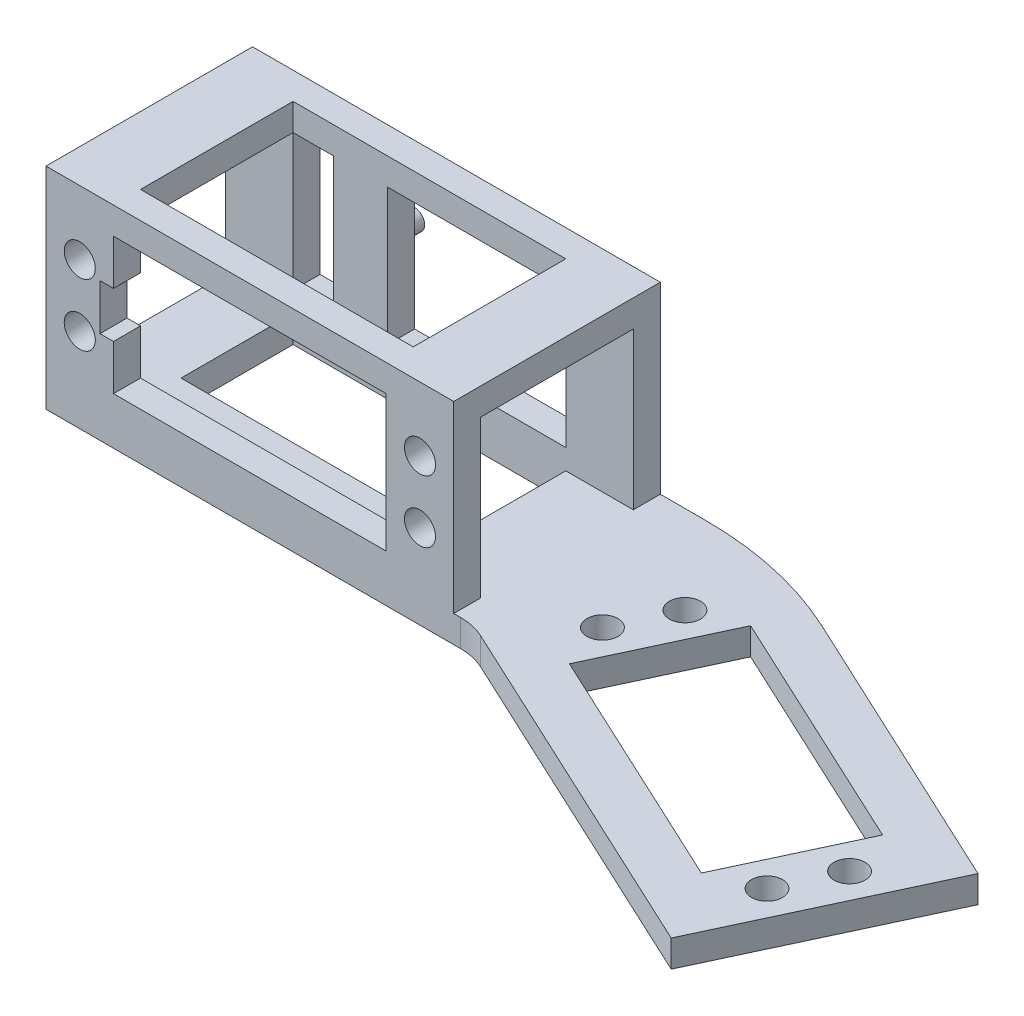
from build123d import *

# Parameters (mm, degrees)
SZKIC1_W                    = 60.4
SZKIC1_H                    = 34.2
DODANIE_WYCI_GNI_CIE1_DEPTH = 4
SZKIC2_R                    = 2.3
DODANIE_WYCI_GNI_CIE2_DEPTH = 4
SZKIC8_W                    = 60.4
SZKIC8_H                    = 32.2
SZKIC8_R                    = 2.3
SZKIC8_W_2                  = 40.4
SZKIC8_H_2                  = 20.2
DODANIE_WYCI_GNI_CIE3_DEPTH = 4
SZKIC10_R                   = 1.5
DODANIE_WYCI_GNI_CIE4_DEPTH = 4
DODANIE_WYCI_GNI_CIE5_START = -2
SZKIC11_W                   = 10
SZKIC11_H                   = 30.6
DODANIE_WYCI_GNI_CIE5_DEPTH = 5
WYTNIJ_WYCI_GNI_CIE1_DEPTH  = 3
SZKIC13_W                   = 6
SZKIC13_H                   = 20.2
SZKIC13_W_2                 = 26.4
WYTNIJ_WYCI_GNI_CIE2_DEPTH  = 4
WYTNIJ_WYCI_GNI_CIE3_REACH  = 189.798
SZKIC14_W                   = 2
SZKIC14_H                   = 6.8


with BuildPart() as part:
    # Szkic1 → Dodanie-wyciągnięcie1 (new body)
    with BuildSketch(Plane.XY):
        with Locations((20.2, 10.1)):
            Rectangle(SZKIC1_W, SZKIC1_H)
    extrude(amount=DODANIE_WYCI_GNI_CIE1_DEPTH)

    # Szkic2 → Dodanie-wyciągnięcie2 (add)
    with BuildSketch(Plane.XZ.offset(7)):
        with BuildLine():
            Line((-10, 4), (-10, 0))
            Line((-10, 0), (-16.721262857, 0))
            ThreePointArc((-16.721262857, 0), (-28.023032854, 1.237745118), (-38.789008699, 4.89230147))
            Line((-38.789008699, 4.89230147), (-82.189786852, 25.130416692))
            Line((-82.189786852, 25.130416692), (-67.736242301, 56.126143009))
            Line((-67.736242301, 56.126143009), (-14.803564356, 31.443229917))
            ThreePointArc((-14.803564356, 31.443229917), (-12.947956525, 30.813335936), (-11, 30.6))
            Line((-11, 30.6), (-10, 30.6))
            Line((-10, 30.6), (50.4, 30.6))
            Line((50.4, 30.6), (50.4, 4))
            Line((50.4, 4), (40.4, 4))
            Line((40.4, 4), (40.4, 20.6))
            Line((40.4, 20.6), (0, 20.6))
            Line((0, 20.6), (0, 4))
            Line((0, 4), (-10, 4))
        make_face()
        with Locations(Location((-68.487431637, 42.684204362, 0), (0, 0, 270))):
            Circle(SZKIC2_R, mode=Mode.SUBTRACT)
        with Locations(Location((-22.809519171, 21.384243971, 0), (0, 0, 90))):
            Circle(SZKIC2_R, mode=Mode.SUBTRACT)
        with Locations(Location((-26.697607179, 13.04621233, 0), (0, 0, 270))):
            Circle(SZKIC2_R, mode=Mode.SUBTRACT)
        with Locations(Location((-72.375519645, 34.346172722, 0), (0, 0, 90))):
            Circle(SZKIC2_R, mode=Mode.SUBTRACT)
        Polygon((-61.631492263, 45.555805882), (-70.16838115, 27.248388584), (-33.553546554, 10.17461081), (-25.016657666, 28.482028108), align=None, mode=Mode.SUBTRACT)
    extrude(amount=-DODANIE_WYCI_GNI_CIE2_DEPTH)

    # Szkic8 → Dodanie-wyciągnięcie3 (add)
    with BuildSketch(Plane.XY.offset(30.6)):
        with Locations((20.2, 9.1)):
            Rectangle(SZKIC8_W, SZKIC8_H)
        with Locations((-5, 14.7)):
            Circle(SZKIC8_R, mode=Mode.SUBTRACT)
        with Locations(Location((-5, 5.5, 0), (0, 0, 180))):
            Circle(SZKIC8_R, mode=Mode.SUBTRACT)
        with Locations((45.4, 5.5)):
            Circle(SZKIC8_R, mode=Mode.SUBTRACT)
        with Locations(Location((45.4, 14.7, 0), (0, 0, 180))):
            Circle(SZKIC8_R, mode=Mode.SUBTRACT)
        with Locations((20.2, 10.1)):
            Rectangle(SZKIC8_W_2, SZKIC8_H_2, mode=Mode.SUBTRACT)
    extrude(amount=-DODANIE_WYCI_GNI_CIE3_DEPTH)

    # Szkic10 → Dodanie-wyciągnięcie4 (add)
    with BuildSketch(Plane(origin=(0, 0, 0), x_dir=(-1, 0, 0), z_dir=(0, 0, -1))):
        with Locations(Location((-30.4, 10.1, 0), (0, 0, 180))):
            Circle(SZKIC10_R)
    extrude(amount=DODANIE_WYCI_GNI_CIE4_DEPTH)

    # Szkic11 → Dodanie-wyciągnięcie5 (add)
    with BuildSketch(Plane(origin=(0, 27.2, 0), x_dir=(1, 0, 0), z_dir=(0, 1, 0)).offset(DODANIE_WYCI_GNI_CIE5_START)):
        with Locations((-5, -15.3)):
            Rectangle(SZKIC11_W, SZKIC11_H)
        with Locations((45.4, -15.3)):
            Rectangle(SZKIC11_W, SZKIC11_H)
    extrude(amount=-DODANIE_WYCI_GNI_CIE5_DEPTH)

    # Szkic12 → Wytnij-wyciągnięcie1 (cut)
    with BuildSketch(Plane(origin=(0, 27.2, 0), x_dir=(1, 0, 0), z_dir=(0, 1, 0))):
        Polygon((-10, 0), (50.4, 0), (50.4, -4), (50.4, -30.6), (-10, -30.6), (-10, -4), align=None)
    extrude(amount=-WYTNIJ_WYCI_GNI_CIE1_DEPTH, mode=Mode.SUBTRACT)

    # Szkic13 → Wytnij-wyciągnięcie2 (cut)
    with BuildSketch(Plane(origin=(0, 0, 0), x_dir=(-1, 0, 0), z_dir=(0, 0, -1))):
        with Locations((-37.4, 10.1)):
            Rectangle(SZKIC13_W, SZKIC13_H)
        with Locations((-13.2, 10.1)):
            Rectangle(SZKIC13_W_2, SZKIC13_H)
    extrude(amount=-WYTNIJ_WYCI_GNI_CIE2_DEPTH, mode=Mode.SUBTRACT)


with BuildPart() as body_2:
    # Lustro1: mirrored copy
    add(part.part.mirror(Plane(origin=(50.4, 27.2, 4), x_dir=(0, 0, 1), z_dir=(-1, 0, 0))))

    # Szkic14 → Wytnij-wyciągnięcie3 (cut, up to next)
    with BuildSketch(Plane.XY.offset(30.6), mode=Mode.PRIVATE) as wytnij_wyci_gni_cie3_sk1:
        with Locations((59.4, 10.1)):
            Rectangle(SZKIC14_W, SZKIC14_H)
    wytnij_wyci_gni_cie3_tool1 = extrude(wytnij_wyci_gni_cie3_sk1.sketch, amount=-WYTNIJ_WYCI_GNI_CIE3_REACH, mode=Mode.PRIVATE) & body_2.part
    add(wytnij_wyci_gni_cie3_tool1.solids().sort_by_distance((59.4, 10.1, 30.6))[0], mode=Mode.SUBTRACT)


solid = body_2.part
